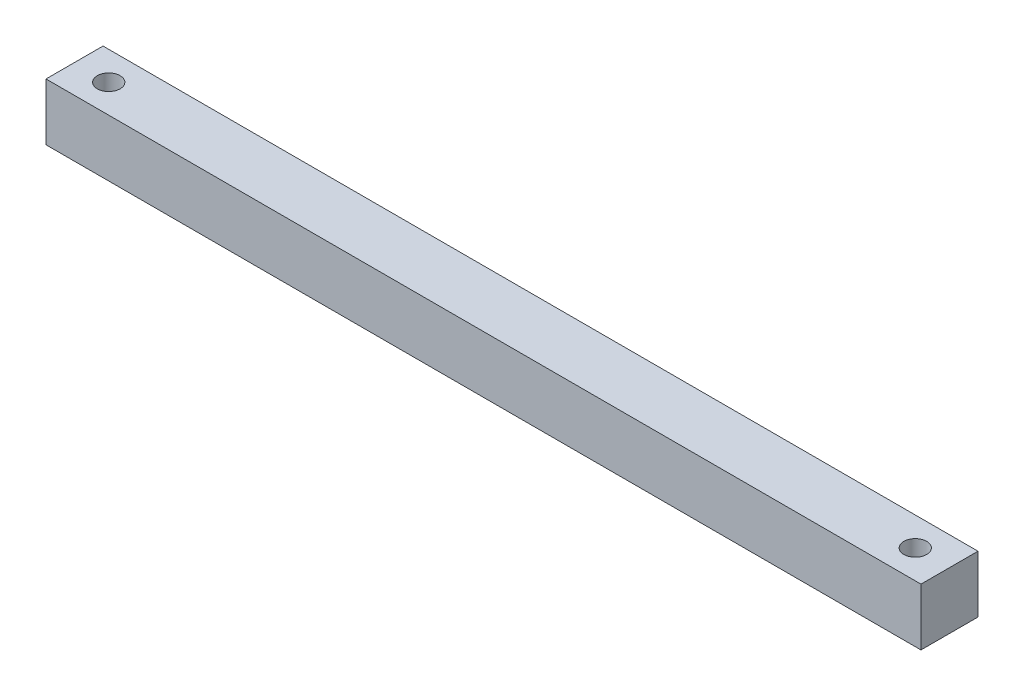
from build123d import *

# Parameters (mm, degrees)
SKETCH2_W           = 76.71067812
SKETCH2_H           = 5
BOSS_EXTRUDE1_DEPTH = 5
SKETCH3_R           = 1
CUT_EXTRUDE1_DEPTH  = 40.001692712


with BuildPart() as part:
    # Sketch2 → Boss-Extrude1 (new body)
    with BuildSketch(Plane.XY):
        Rectangle(SKETCH2_W, SKETCH2_H)
    extrude(amount=BOSS_EXTRUDE1_DEPTH)

    # Sketch3 → Cut-Extrude1 (cut, through all)
    with BuildSketch(Plane(origin=(0, 2.5, 0), x_dir=(1, 0, 0), z_dir=(0, 1, 0))):
        with Locations(Location((-35.35533906, -2.5, 0), (0, 0, 270))):
            Circle(SKETCH3_R)
        with Locations(Location((35.35533906, -2.5, 0), (0, 0, 270))):
            Circle(SKETCH3_R)
    extrude(amount=-CUT_EXTRUDE1_DEPTH, mode=Mode.SUBTRACT)


solid = part.part
